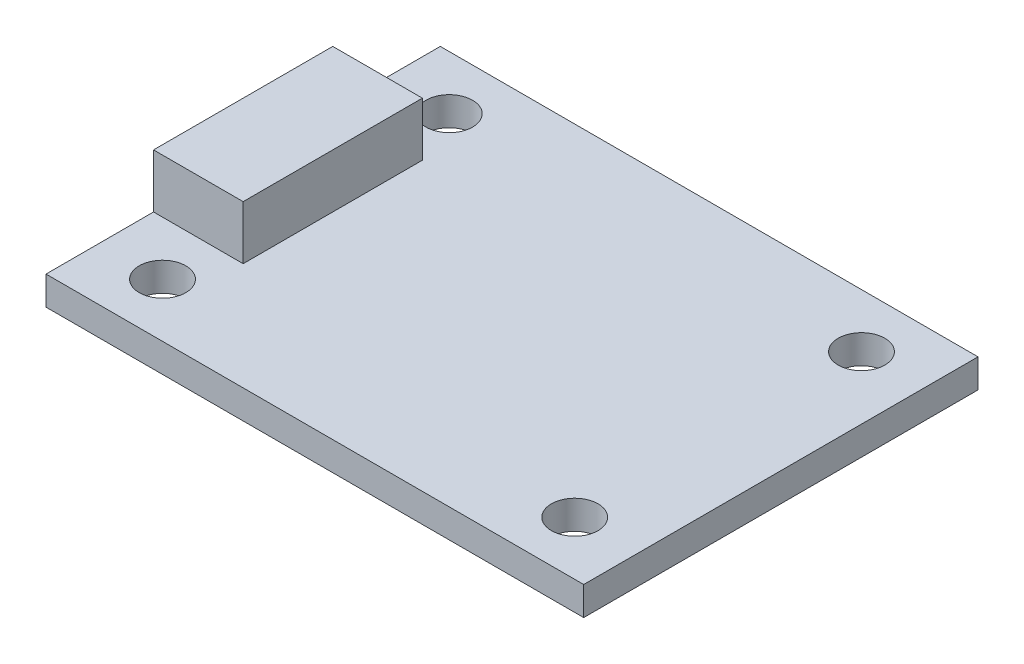
from build123d import *

# Parameters (mm, degrees)
SKETCH_1_W      = 30
SKETCH_1_H      = 22
SKETCH_1_R      = 1.3
EXTRUDE_1_DEPTH = 1.6
SKETCH_2_W      = 5
SKETCH_2_H      = 10
EXTRUDE_2_DEPTH = 3


with BuildPart() as part:
    # 草图1 → 凸台-拉伸1 (new body)
    with BuildSketch(Plane(origin=(0, 0, 0), x_dir=(1, 0, 0), z_dir=(0, 1, 0))):
        with Locations((15, 11)):
            Rectangle(SKETCH_1_W, SKETCH_1_H)
        with Locations(Location((3.5, 3, 0), (0, 0, 270))):
            Circle(SKETCH_1_R, mode=Mode.SUBTRACT)
        with Locations(Location((26.5, 3, 0), (0, 0, 270))):
            Circle(SKETCH_1_R, mode=Mode.SUBTRACT)
        with Locations(Location((26.5, 19, 0), (0, 0, 90))):
            Circle(SKETCH_1_R, mode=Mode.SUBTRACT)
        with Locations(Location((3.5, 19, 0), (0, 0, 90))):
            Circle(SKETCH_1_R, mode=Mode.SUBTRACT)
    extrude(amount=EXTRUDE_1_DEPTH)

    # 草图2 → 凸台-拉伸2 (add)
    with BuildSketch(Plane(origin=(0, 1.6, 0), x_dir=(1, 0, 0), z_dir=(0, 1, 0))):
        with Locations((2.5, 11)):
            Rectangle(SKETCH_2_W, SKETCH_2_H)
    extrude(amount=EXTRUDE_2_DEPTH)


solid = part.part
